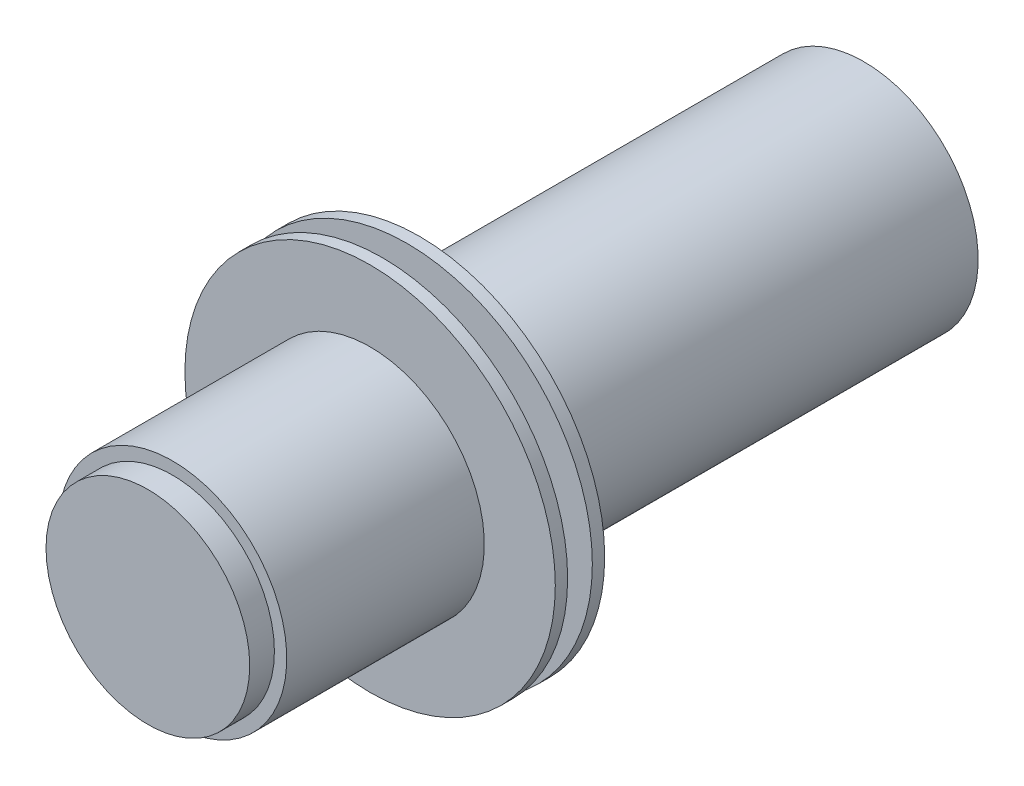
from build123d import *

# Parameters (mm, degrees)
SKETCH1_R           = 9.25
BOSS_EXTRUDE1_DEPTH = 58
CUT_EXTRUDE1_START  = -2
SKETCH2_R           = 9.25
SKETCH2_R_2         = 8.25
CUT_EXTRUDE1_DEPTH  = 2
SKETCH3_R           = 15
BOSS_EXTRUDE2_DEPTH = 1
LPATTERN1_COUNT     = 2
LPATTERN1_PITCH     = 3


with BuildPart() as part:
    # Sketch1 → Boss-Extrude1 (new body)
    with BuildSketch(Plane.XY):
        with Locations(Location((0, 0, 0), (0, 0, 180))):
            Circle(SKETCH1_R)
    extrude(amount=BOSS_EXTRUDE1_DEPTH)

    # Sketch2 → Cut-Extrude1 (cut)
    with BuildSketch(Plane.XY.offset(58).offset(CUT_EXTRUDE1_START)):
        with Locations(Location((0, 0, 0), (0, 0, 180))):
            Circle(SKETCH2_R)
        Circle(SKETCH2_R_2, mode=Mode.SUBTRACT)
    extrude(amount=CUT_EXTRUDE1_DEPTH, mode=Mode.SUBTRACT)

    # Sketch3 → Boss-Extrude2 (add)
    with BuildSketch(Plane.XY.offset(36)):
        Circle(SKETCH3_R)
    boss_extrude2 = extrude(amount=BOSS_EXTRUDE2_DEPTH)

    # LPattern1: Boss-Extrude2 ×2
    with Locations(*[(0, 0, i * LPATTERN1_PITCH) for i in range(1, LPATTERN1_COUNT)]):
        add(boss_extrude2)


solid = part.part
